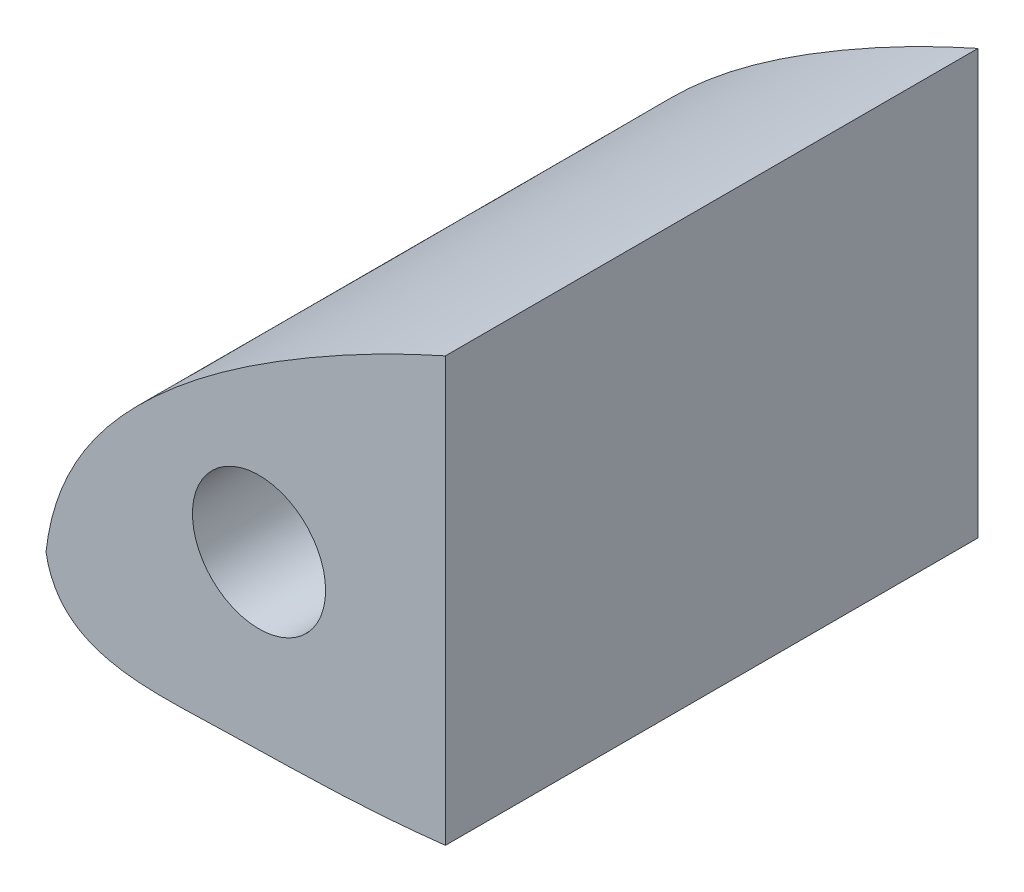
from build123d import *

# Parameters (mm, degrees)
BOSS_EXTRUDE1_DEPTH = 50.8
SKETCH2_R           = 6.35
SKETCH2_R_2         = 3.175
CUT_EXTRUDE1_DEPTH  = 320.788688435
SKETCH3_W           = 293.188888759
SKETCH3_H           = 137.971241769
CUT_EXTRUDE2_DEPTH  = 320.788688435


with BuildPart() as part:
    # Sketch1 → Boss-Extrude1 (new body)
    with BuildSketch(Plane.XY):
        with BuildLine():
            add(Edge.make_bspline(
                [(0.000560351, 0.000130087), (0.810633127, 7.359196055), (8.649092025, 17.856605174), (26.286719818, 29.975176328), (52.111128271, 42.069215275), (89.597618475, 49.290763054), (131.400792109, 47.884831915), (173.256699242, 40.041104278), (217.961060472, 29.612974894), (256.952064401, 19.528920948), (290.35983767, 8.71099439), (301.273197721, 4.382828139), (314.816918223, -0.516206742), (309.846313895, 0.000130087)],
                knots=[0, 0, 0, 0, 0.060863618, 0.113688265, 0.188608742, 0.312908923, 0.448482434, 0.557612135, 0.691544113, 0.852438279, 0.92975597, 0.976058229, 1, 1, 1, 1], degree=3))
            add(Edge.make_bspline(
                [(309.846313895, 0.000130087), (303.956832565, 1.47095521), (293.989507544, 2.093987313), (276.26402299, 4.514356704), (260.846344817, 5.427413394), (235.858814759, 7.870306192), (205.101424636, 8.838080282), (157.718638092, 9.030650149), (110.497331172, 6.181495223), (66.506197185, -0.586669107), (36.454672816, -6.098499901), (15.316603331, -6.189065841), (1.230714189, -6.924076091), (0.000560351, 0.000130087)],
                knots=[0, 0, 0, 0, 0.057787081, 0.095274891, 0.171021118, 0.205339302, 0.335319146, 0.464904334, 0.658702312, 0.785511947, 0.893517288, 0.94309214, 1, 1, 1, 1], degree=3))
        make_face()
    extrude(amount=BOSS_EXTRUDE1_DEPTH)

    # Sketch2 → Cut-Extrude1 (cut, through all)
    with BuildSketch(Plane.XY.offset(50.8)):
        with Locations((20.32, 10.16)):
            Circle(SKETCH2_R)
        with Locations((227.296313895, 19.050130087)):
            Circle(SKETCH2_R_2)
    extrude(amount=-CUT_EXTRUDE1_DEPTH, mode=Mode.SUBTRACT)

    # Sketch3 → Cut-Extrude2 (cut, through all)
    with BuildSketch(Plane.XY.offset(50.8)):
        with Locations((184.69444438, 2.732377951)):
            Rectangle(SKETCH3_W, SKETCH3_H)
    extrude(amount=-CUT_EXTRUDE2_DEPTH, mode=Mode.SUBTRACT)


solid = part.part
